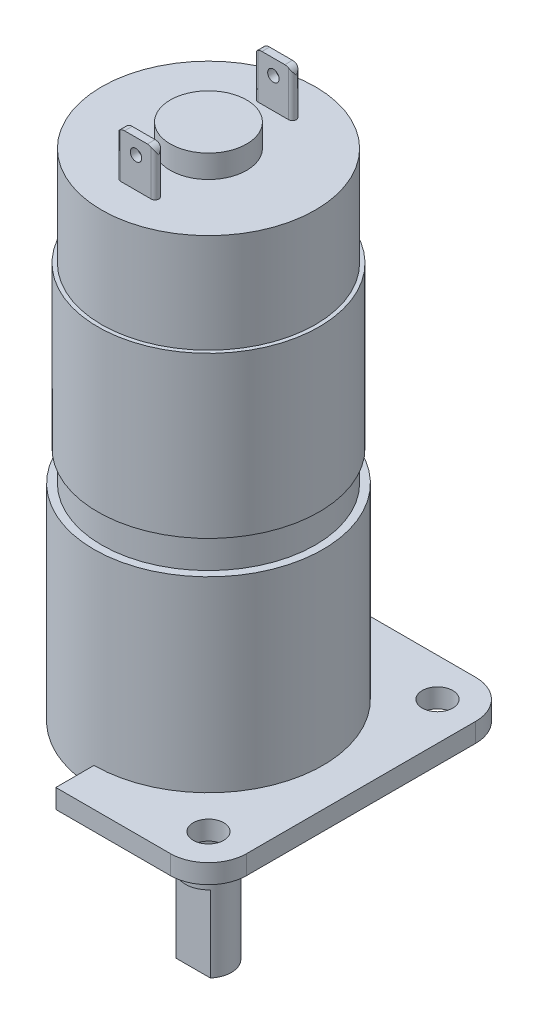
from build123d import *

# Parameters (mm, degrees)
CROQUIS1_R               = 14
MOTOR_DEPTH              = 38
CROQUIS2_R               = 5
SALIENTE_POSTERIOR_DEPTH = 3
BORNES_DEPTH             = 6
CROQUIS4_R               = 0.75
AGUJERO_BORNES_DEPTH     = 52.809748118
CROQUIS5_R               = 15
CAJA_REDUCTORA_DEPTH     = 24.5
CROQUIS6_R               = 2
BRIDA_DEPTH              = 2.5
CROQUIS7_R               = 6.5
SALIENTE_EJE_DEPTH       = 13.5
CROQUIS8_R               = 3
EJE_DEPTH                = 13.5
CORTE_PLANO_EJE_DEPTH    = 10
CROQUIS10_R              = 2
CORTE_BRIDA_DEPTH        = 10
SALIENTE_EXTRUIR1_START  = 4
CROQUIS11_R              = 14.5
SALIENTE_EXTRUIR1_DEPTH  = 21


with BuildPart() as part:
    # Croquis1 → Motor (new body)
    with BuildSketch(Plane(origin=(0, 0, 0), x_dir=(1, 0, 0), z_dir=(0, 1, 0))):
        with Locations(Location((0, 0, 0), (0, 0, 270))):
            Circle(CROQUIS1_R)
    extrude(amount=MOTOR_DEPTH)

    # Croquis2 → Saliente posterior (add)
    with BuildSketch(Plane(origin=(0, 38, 0), x_dir=(1, 0, 0), z_dir=(0, 1, 0))):
        with Locations(Location((0, 0, 0), (0, 0, 270))):
            Circle(CROQUIS2_R)
    extrude(amount=SALIENTE_POSTERIOR_DEPTH)

    # Croquis3 → Bornes (add)
    with BuildSketch(Plane(origin=(0, 38, 0), x_dir=(1, 0, 0), z_dir=(0, 1, 0))):
        with BuildLine():
            Line((-2, 9.5), (2, 9.5))
            ThreePointArc((2, 9.5), (2.5, 9), (2, 8.5))
            Line((2, 8.5), (-2, 8.5))
            ThreePointArc((-2, 8.5), (-2.5, 9), (-2, 9.5))
        make_face()
        with BuildLine():
            Line((-2, -9.5), (2, -9.5))
            ThreePointArc((2, -9.5), (2.5, -9), (2, -8.5))
            Line((2, -8.5), (-2, -8.5))
            ThreePointArc((-2, -8.5), (-2.5, -9), (-2, -9.5))
        make_face()
    extrude(amount=BORNES_DEPTH)

    # Croquis4 → Agujero Bornes (cut, through all)
    with BuildSketch(Plane.XY.offset(9.5)):
        with Locations((0, 42)):
            Circle(CROQUIS4_R)
        with BuildLine():
            ThreePointArc((2, 43.866025404), (2.366025404, 43.5), (2.5, 43))
            Line((2.5, 43), (2.5, 44))
            Line((2.5, 44), (2, 44))
            Line((2, 44), (2, 43.866025404))
        make_face()
        with BuildLine():
            ThreePointArc((1.5, 44), (1.758819045, 43.965925826), (2, 43.866025404))
            Line((2, 43.866025404), (2, 44))
            Line((2, 44), (1.5, 44))
        make_face()
        with BuildLine():
            Line((-2, 43.866025404), (-2, 44))
            Line((-2, 44), (-2.5, 44))
            Line((-2.5, 44), (-2.5, 43))
            ThreePointArc((-2.5, 43), (-2.366025404, 43.5), (-2, 43.866025404))
        make_face()
        with BuildLine():
            ThreePointArc((-2, 43.866025404), (-1.758819045, 43.965925826), (-1.5, 44))
            Line((-1.5, 44), (-2, 44))
            Line((-2, 44), (-2, 43.866025404))
        make_face()
    extrude(amount=-AGUJERO_BORNES_DEPTH, mode=Mode.SUBTRACT)

    # Croquis5 → Caja reductora (add)
    with BuildSketch(Plane.XZ):
        with Locations(Location((0, 0, 0), (0, 0, 270))):
            Circle(CROQUIS5_R)
    extrude(amount=CAJA_REDUCTORA_DEPTH)

    # Croquis6 → Brida (add)
    with BuildSketch(Plane.XZ.offset(24.5)):
        with BuildLine():
            Line((-15, 20), (15, 20))
            ThreePointArc((15, 20), (18.535533906, 18.535533906), (20, 15))
            Line((20, 15), (20, -15))
            ThreePointArc((20, -15), (18.535533906, -18.535533906), (15, -20))
            Line((15, -20), (-15, -20))
            ThreePointArc((-15, -20), (-18.535533906, -18.535533906), (-20, -15))
            Line((-20, -15), (-20, 15))
            ThreePointArc((-20, 15), (-18.535533906, 18.535533906), (-15, 20))
        make_face()
        with Locations(Location((-15, 15, 0), (0, 0, 270))):
            Circle(CROQUIS6_R, mode=Mode.SUBTRACT)
        with Locations(Location((15, 15, 0), (0, 0, 270))):
            Circle(CROQUIS6_R, mode=Mode.SUBTRACT)
        with Locations(Location((15, -15, 0), (0, 0, 270))):
            Circle(CROQUIS6_R, mode=Mode.SUBTRACT)
        with Locations(Location((-15, -15, 0), (0, 0, 270))):
            Circle(CROQUIS6_R, mode=Mode.SUBTRACT)
    extrude(amount=BRIDA_DEPTH)

    # Croquis7 → Saliente eje (add)
    with BuildSketch(Plane.XZ.offset(27)):
        with Locations(Location((0, 0, 0), (0, 0, 270))):
            Circle(CROQUIS7_R)
    extrude(amount=SALIENTE_EJE_DEPTH)

    # Croquis8 → Eje (add)
    with BuildSketch(Plane.XZ.offset(40.5)):
        with Locations(Location((0, 0, 0), (0, 0, 270))):
            Circle(CROQUIS8_R)
    extrude(amount=EJE_DEPTH)

    # Croquis9 → Corte Plano eje (cut)
    with BuildSketch(Plane.XZ.offset(54)):
        Polygon((-74.796206056, 2), (-2.236067977, 2), (2.236067977, 2), (74.796206056, 2), (74.796206056, 147.120276157), (-74.796206056, 147.120276157), align=None)
    extrude(amount=-CORTE_PLANO_EJE_DEPTH, mode=Mode.SUBTRACT)

    # Croquis10 → Corte Brida (cut)
    with BuildSketch(Plane(origin=(0, -24.5, 0), x_dir=(1, 0, 0), z_dir=(0, 1, 0))):
        with BuildLine():
            Line((0, 15), (0, 20))
            Line((0, 20), (-15, 20))
            ThreePointArc((-15, 20), (-18.535533906, 18.535533906), (-20, 15))
            Line((-20, 15), (-20, -15))
            ThreePointArc((-20, -15), (-18.535533906, -18.535533906), (-15, -20))
            Line((-15, -20), (0, -20))
            Line((0, -20), (0, -15))
            ThreePointArc((0, -15), (-15, 0), (0, 15))
        make_face()
        with Locations((-15, -15)):
            Circle(CROQUIS10_R, mode=Mode.SUBTRACT)
        with Locations((-15, 15)):
            Circle(CROQUIS10_R, mode=Mode.SUBTRACT)
    extrude(amount=-CORTE_BRIDA_DEPTH, mode=Mode.SUBTRACT)

    # Croquis11 → Saliente-Extruir1 (add)
    with BuildSketch(Plane(origin=(0, 0, 0), x_dir=(1, 0, 0), z_dir=(0, 1, 0)).offset(SALIENTE_EXTRUIR1_START)):
        with Locations(Location((0, 0, 0), (0, 0, 90))):
            Circle(CROQUIS11_R)
    extrude(amount=SALIENTE_EXTRUIR1_DEPTH)


solid = part.part
